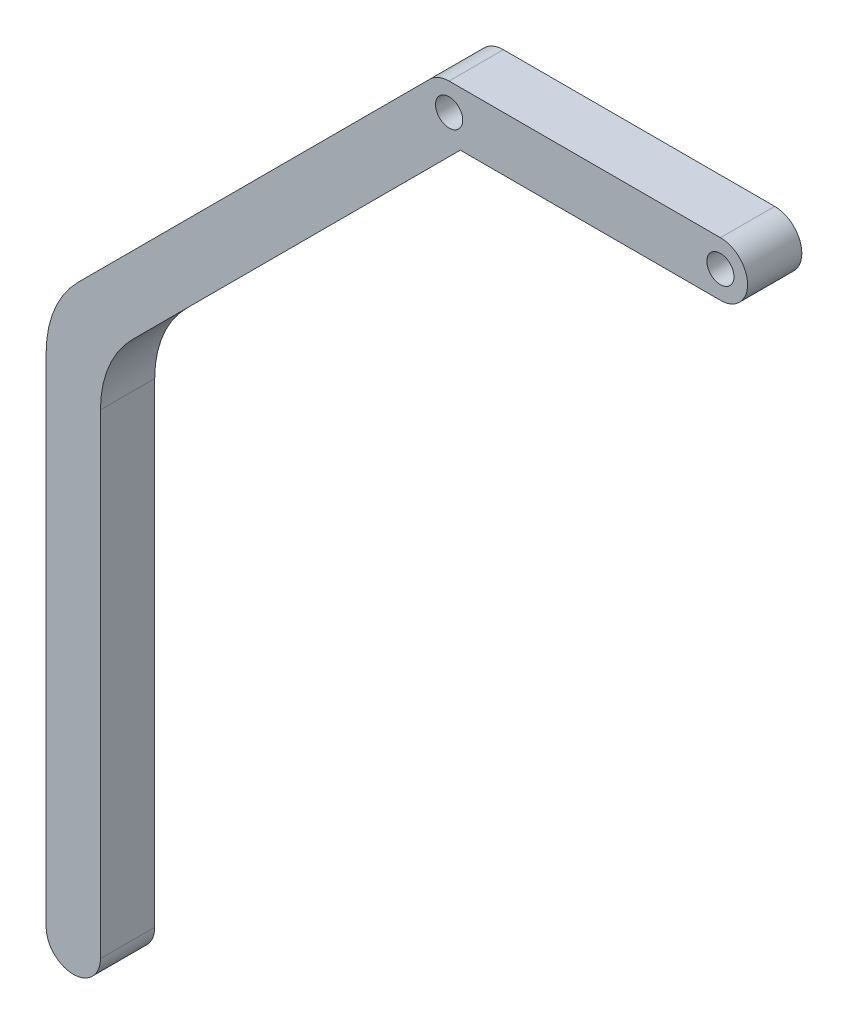
from build123d import *

# Parameters (mm, degrees)
SKETCH3_R           = 2.5
BOSS_EXTRUDE1_DEPTH = 10


with BuildPart() as part:
    # Sketch3 → Boss-Extrude1 (new body)
    with BuildSketch(Plane.XY):
        with BuildLine():
            Line((0, 5), (50, 5))
            ThreePointArc((50, 5), (55, 0), (50, -5))
            Line((50, -5), (2.071067812, -5))
            Line((2.071067812, -5), (-58.388347648, -65.45941546))
            ThreePointArc((-58.388347648, -65.45941546), (-62.723802675, -71.947882437), (-64.246212025, -79.601551084))
            Line((-64.246212025, -79.601551084), (-64.246212025, -167.175144213))
            ThreePointArc((-64.246212025, -167.175144213), (-69.246212025, -172.175144213), (-74.246212025, -167.175144213))
            Line((-74.246212025, -167.175144213), (-74.246212025, -75.45941546))
            ThreePointArc((-74.246212025, -75.45941546), (-72.723802675, -67.805746813), (-68.388347648, -61.317279836))
            Line((-68.388347648, -61.317279836), (-3.535533906, 3.535533906))
            ThreePointArc((-3.535533906, 3.535533906), (-1.913417162, 4.619397663), (0, 5))
        make_face()
        Circle(SKETCH3_R, mode=Mode.SUBTRACT)
        with Locations((50, 0)):
            Circle(SKETCH3_R, mode=Mode.SUBTRACT)
    extrude(amount=BOSS_EXTRUDE1_DEPTH)


solid = part.part
